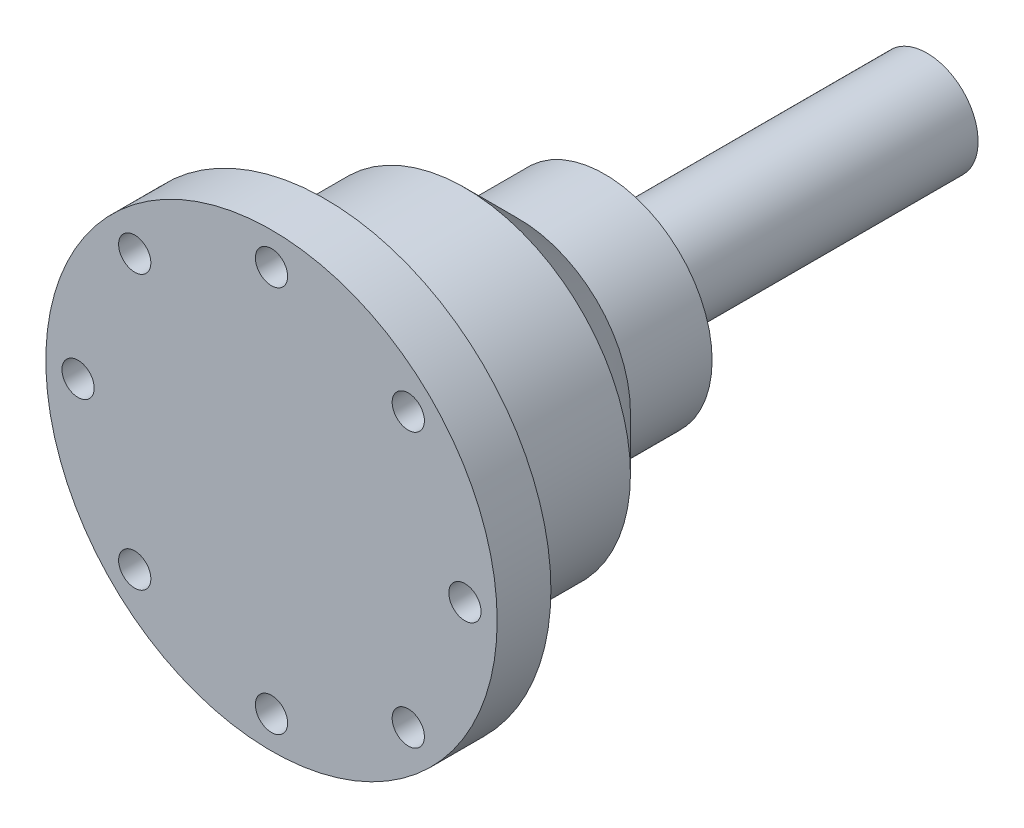
from build123d import *

# Parameters (mm, degrees)
SKETCH1_R           = 21
BOSS_EXTRUDE1_DEPTH = 5
SKETCH2_R           = 1.5
CUT_EXTRUDE1_DEPTH  = 31.116440693
SKETCH1_3_R         = 10
BOSS_EXTRUDE2_DEPTH = 26
CIRPATTERN1_COUNT   = 8
SKETCH1_4_R         = 15.4
SKETCH1_4_R_2       = 10
BOSS_EXTRUDE3_DEPTH = 18
CHAMFER2_SIZE       = 5
SKETCH3_R           = 4.75
BOSS_EXTRUDE4_DEPTH = 30


with BuildPart() as part:
    # Sketch1 → Boss-Extrude1 (new body)
    with BuildSketch(Plane.XY):
        Circle(SKETCH1_R)
    extrude(amount=BOSS_EXTRUDE1_DEPTH)

    # Sketch2 → Cut-Extrude1 (cut, through all)
    with BuildSketch(Plane(origin=(0, 0, 0), x_dir=(-1, 0, 0), z_dir=(0, 0, -1))):
        with Locations((0, 18)):
            Circle(SKETCH2_R)
    cut_extrude1 = extrude(amount=-CUT_EXTRUDE1_DEPTH, mode=Mode.SUBTRACT)

    # Sketch1<3> → Boss-Extrude2 (add)
    with BuildSketch(Plane.XY):
        Circle(SKETCH1_3_R)
    extrude(amount=-BOSS_EXTRUDE2_DEPTH)

    # CirPattern1: Cut-Extrude1 ×8 about axis
    cirpattern1_axis = Axis((0, 0, -26), (0, 0, 1))
    for i in range(1, CIRPATTERN1_COUNT):
        add(cut_extrude1.rotate(cirpattern1_axis, i * 360 / CIRPATTERN1_COUNT), mode=Mode.SUBTRACT)

    # Sketch1<4> → Boss-Extrude3 (add)
    with BuildSketch(Plane.XY):
        Circle(SKETCH1_4_R)
        Circle(SKETCH1_4_R_2, mode=Mode.SUBTRACT)
    extrude(amount=-BOSS_EXTRUDE3_DEPTH)

    # Chamfer2
    chamfer2_edges = [part.edges().sort_by_distance(p)[0] for p in [
        (-15.4, 0, -18),
    ]]
    chamfer(chamfer2_edges, length=CHAMFER2_SIZE)

    # Sketch3 → Boss-Extrude4 (add)
    with BuildSketch(Plane(origin=(0, 0, -26), x_dir=(-1, 0, 0), z_dir=(0, 0, -1))):
        Circle(SKETCH3_R)
    extrude(amount=BOSS_EXTRUDE4_DEPTH)


solid = part.part
